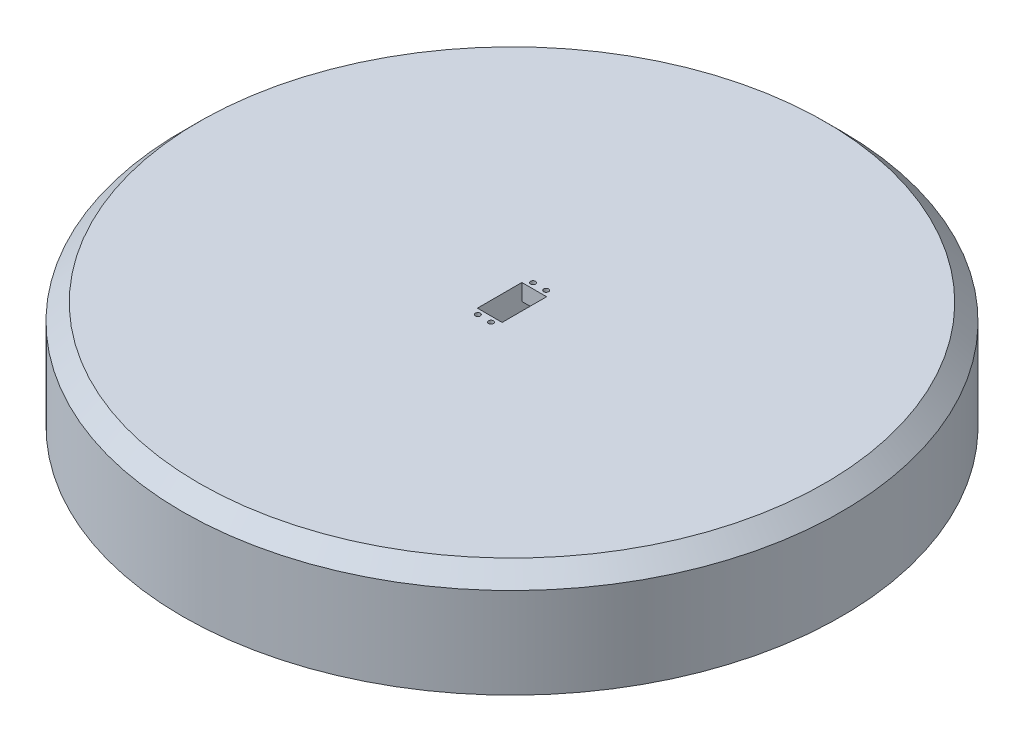
from build123d import *

# Parameters (mm, degrees)
SKETCH1_R           = 200
BOSS_EXTRUDE1_DEPTH = 65
SKETCH2_W           = 15
SKETCH2_H           = 27
CUT_EXTRUDE1_DEPTH  = 291.215437219
SKETCH3_W           = 15
SKETCH3_H           = 40
CUT_EXTRUDE2_DEPTH  = 55
CHAMFER1_SIZE       = 10
SKETCH4_R           = 1.5
CUT_EXTRUDE3_DEPTH  = 289.140590684


with BuildPart() as part:
    # Sketch1 → Boss-Extrude1 (new body)
    with BuildSketch(Plane(origin=(0, 0, 0), x_dir=(1, 0, 0), z_dir=(0, 1, 0))):
        with Locations(Location((0, 0, 0), (0, 0, 270))):
            Circle(SKETCH1_R)
    extrude(amount=BOSS_EXTRUDE1_DEPTH)

    # Sketch2 → Cut-Extrude1 (cut, through all)
    with BuildSketch(Plane(origin=(0, 65, 0), x_dir=(1, 0, 0), z_dir=(0, 1, 0))):
        Rectangle(SKETCH2_W, SKETCH2_H)
    extrude(amount=-CUT_EXTRUDE1_DEPTH, mode=Mode.SUBTRACT)

    # Sketch3 → Cut-Extrude2 (cut)
    with BuildSketch(Plane.XZ):
        Rectangle(SKETCH3_W, SKETCH3_H)
    extrude(amount=-CUT_EXTRUDE2_DEPTH, mode=Mode.SUBTRACT)

    # Chamfer1
    chamfer1_edges = [part.edges().sort_by_distance(p)[0] for p in [
        (0, 65, -200),
    ]]
    chamfer(chamfer1_edges, length=CHAMFER1_SIZE)

    # Sketch4 → Cut-Extrude3 (cut, through all)
    with BuildSketch(Plane(origin=(0, 55, 0), x_dir=(-1, 0, 0), z_dir=(0, -1, 0))):
        with Locations(Location((4, -16.75, 0), (0, 0, 90))):
            Circle(SKETCH4_R)
        with Locations(Location((-4, -16.75, 0), (0, 0, 270))):
            Circle(SKETCH4_R)
        with Locations(Location((4, 16.75, 0), (0, 0, 270))):
            Circle(SKETCH4_R)
        with Locations(Location((-4, 16.75, 0), (0, 0, 90))):
            Circle(SKETCH4_R)
    extrude(amount=-CUT_EXTRUDE3_DEPTH, mode=Mode.SUBTRACT)


solid = part.part
